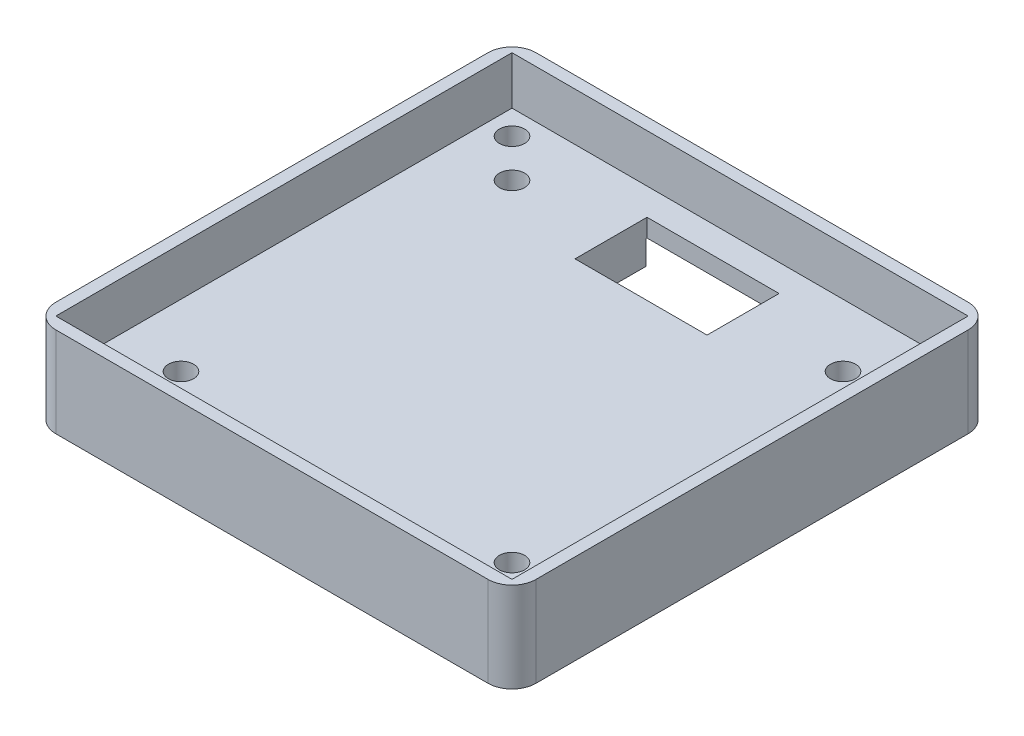
from build123d import *

# Parameters (mm, degrees)
SKETCH1_W           = 40
SKETCH1_H           = 40
BOSS_EXTRUDE1_DEPTH = 3.5
SKETCH2_R           = 1.05
CUT_EXTRUDE1_DEPTH  = 3.5
SKETCH3_W           = 40
SKETCH3_H           = 40
SKETCH3_W_2         = 38
SKETCH3_H_2         = 38
BOSS_EXTRUDE2_DEPTH = 5
FILLET1_R           = 2
SKETCH4_W           = 11
SKETCH4_H           = 6
CUT_EXTRUDE2_DEPTH  = 5
SKETCH5_W           = 15.9
SKETCH5_H           = 32.39
CUT_EXTRUDE7_DEPTH  = 2
SKETCH7_W           = 43.568171074
SKETCH7_H           = 43.096637318
CUT_EXTRUDE9_DEPTH  = 1


with BuildPart() as part:
    # Sketch1 → Boss-Extrude1 (new body)
    with BuildSketch(Plane(origin=(0, 0, 0), x_dir=(1, 0, 0), z_dir=(0, 1, 0))):
        Rectangle(SKETCH1_W, SKETCH1_H)
    extrude(amount=BOSS_EXTRUDE1_DEPTH)

    # Sketch2 → Cut-Extrude1 (cut)
    with BuildSketch(Plane(origin=(0, 3.5, 0), x_dir=(1, 0, 0), z_dir=(0, 1, 0))):
        with Locations(Location((-16.970562748, 16.970562748, 0), (0, 0, 270))):
            Circle(SKETCH2_R)
        with Locations(Location((16.970562748, 16.970562748, 0), (0, 0, 270))):
            Circle(SKETCH2_R)
        with Locations(Location((-16.970562748, -16.970562748, 0), (0, 0, 270))):
            Circle(SKETCH2_R)
        with Locations(Location((16.970562748, -16.970562748, 0), (0, 0, 270))):
            Circle(SKETCH2_R)
        with Locations(Location((-13.788582233, 13.788582233, 0), (0, 0, 270))):
            Circle(SKETCH2_R)
        with Locations(Location((13.788582233, 13.788582233, 0), (0, 0, 270))):
            Circle(SKETCH2_R)
        with Locations(Location((13.788582233, -13.788582233, 0), (0, 0, 270))):
            Circle(SKETCH2_R)
        with Locations(Location((-13.788582233, -13.788582233, 0), (0, 0, 270))):
            Circle(SKETCH2_R)
    extrude(amount=-CUT_EXTRUDE1_DEPTH, mode=Mode.SUBTRACT)

    # Sketch3 → Boss-Extrude2 (add)
    with BuildSketch(Plane(origin=(0, 3.5, 0), x_dir=(1, 0, 0), z_dir=(0, 1, 0))):
        Rectangle(SKETCH3_W, SKETCH3_H)
        Rectangle(SKETCH3_W_2, SKETCH3_H_2, mode=Mode.SUBTRACT)
    extrude(amount=BOSS_EXTRUDE2_DEPTH)

    # Fillet1
    fillet1_edges = [part.edges().sort_by_distance(p)[0] for p in [
        (20, 4.25, 20),
        (-20, 4.25, 20),
        (-20, 4.25, -20),
        (20, 4.25, -20),
    ]]
    fillet(fillet1_edges, radius=FILLET1_R)

    # Sketch4 → Cut-Extrude2 (cut)
    with BuildSketch(Plane(origin=(0, 3.5, 0), x_dir=(1, 0, 0), z_dir=(0, 1, 0))):
        with Locations((0, 13.75)):
            Rectangle(SKETCH4_W, SKETCH4_H)
    extrude(amount=-CUT_EXTRUDE2_DEPTH, mode=Mode.SUBTRACT)

    # Sketch5 → Cut-Extrude7 (cut)
    with BuildSketch(Plane.XZ):
        with BuildLine():
            Line((-7.81, 18.511021166), (7.81, 18.511021166))
            ThreePointArc((7.81, 18.511021166), (9.931320344, 17.632341509), (10.81, 15.511021166))
            Line((10.81, 15.511021166), (10.81, -16.688978834))
            ThreePointArc((10.81, -16.688978834), (9.931320344, -18.810299178), (7.81, -19.688978834))
            Line((7.81, -19.688978834), (-7.81, -19.688978834))
            ThreePointArc((-7.81, -19.688978834), (-9.931320344, -18.810299178), (-10.81, -16.688978834))
            Line((-10.81, -16.688978834), (-10.81, 15.511021166))
            ThreePointArc((-10.81, 15.511021166), (-9.931320344, 17.632341509), (-7.81, 18.511021166))
        make_face()
        with Locations((0, -0.483978834)):
            Rectangle(SKETCH5_W, SKETCH5_H, mode=Mode.SUBTRACT)
    extrude(amount=-CUT_EXTRUDE7_DEPTH, mode=Mode.SUBTRACT)

    # Sketch7 → Cut-Extrude9 (cut)
    with BuildSketch(Plane(origin=(0, 8.5, 0), x_dir=(1, 0, 0), z_dir=(0, 1, 0))):
        Rectangle(SKETCH7_W, SKETCH7_H)
    extrude(amount=-CUT_EXTRUDE9_DEPTH, mode=Mode.SUBTRACT)


solid = part.part
